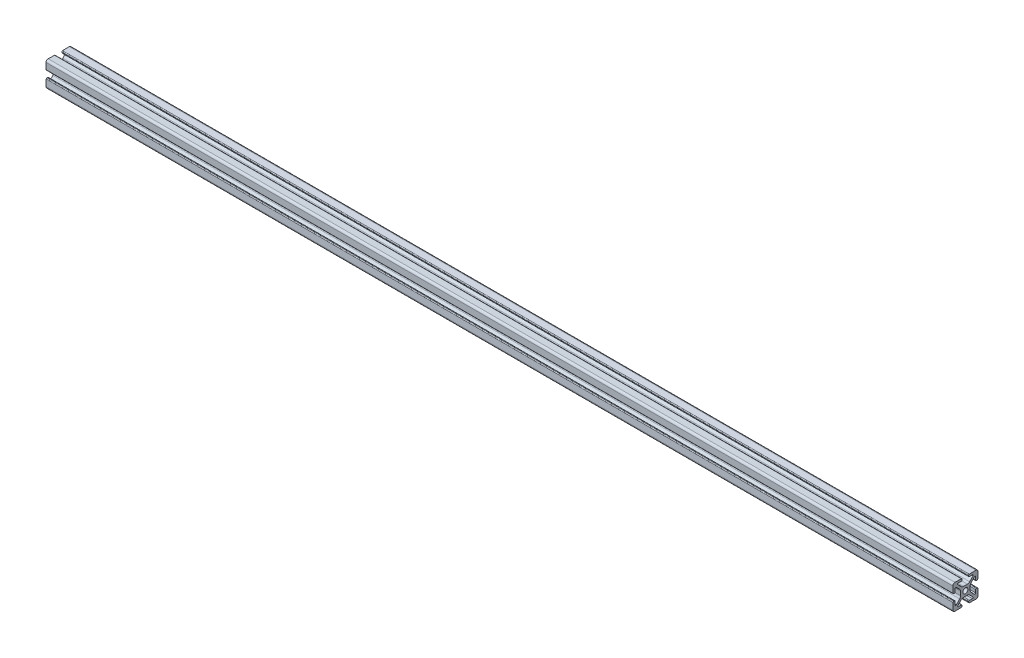
from build123d import *

# Parameters (mm, degrees)
BOSS_EXTRUDE1_DEPTH      = 457.2
BOSS_EXTRUDE1_DEPTH_BACK = 457.2


with BuildPart() as part:
    # Sketch3 → Boss-Extrude1 (new, two sides: drawn at the far end of the back side and taken through both)
    with BuildSketch(Plane(origin=(0, 0, 0), x_dir=(0, 0, -1), z_dir=(1, 0, 0)).offset(-BOSS_EXTRUDE1_DEPTH_BACK)):
        with BuildLine():
            Line((0, 4.826), (1.984228399, 4.826))
            ThreePointArc((1.984228399, 4.826), (3.199248297, 5.067682484), (4.229292429, 5.75593597))
            Line((4.229292429, 5.75593597), (7.586577723, 9.113221264))
            ThreePointArc((7.586577723, 9.113221264), (7.746562132, 9.955883421), (7.021168939, 10.413572441))
            Line((7.021168939, 10.413572441), (4.090593416, 10.311234489))
            ThreePointArc((4.090593416, 10.311234489), (3.534670322, 10.524633371), (3.302, 11.072770299))
            Line((3.302, 11.072770299), (3.302, 11.70815736))
            ThreePointArc((3.302, 11.70815736), (3.515863072, 12.237487038), (4.037406584, 12.46969317))
            Line((4.037406584, 12.46969317), (10.597084223, 12.698762161))
            ThreePointArc((10.597084223, 12.698762161), (12.104840979, 12.104840979), (12.698762161, 10.597084223))
            Line((12.698762161, 10.597084223), (12.46969317, 4.037406584))
            ThreePointArc((12.46969317, 4.037406584), (12.237487038, 3.515863072), (11.70815736, 3.302))
            Line((11.70815736, 3.302), (11.072770299, 3.302))
            ThreePointArc((11.072770299, 3.302), (10.524633371, 3.534670322), (10.311234489, 4.090593416))
            Line((10.311234489, 4.090593416), (10.413572441, 7.021168939))
            ThreePointArc((10.413572441, 7.021168939), (9.955883421, 7.746562132), (9.113221264, 7.586577723))
            Line((9.113221264, 7.586577723), (5.75593597, 4.229292429))
            ThreePointArc((5.75593597, 4.229292429), (5.067682484, 3.199248297), (4.826, 1.984228399))
            Line((4.826, 1.984228399), (4.826, 0))
            Line((4.826, 0), (2.54, 0))
            ThreePointArc((2.54, 0), (1.796051224, 1.796051224), (0, 2.54))
            Line((0, 2.54), (0, 4.826))
        make_face()
    extrude(amount=BOSS_EXTRUDE1_DEPTH + BOSS_EXTRUDE1_DEPTH_BACK)

    # Mirror1: part across plane


with BuildPart() as part_1:
    add(part.part)
    add(part.part.mirror(Plane.ZX))

    # Mirror2: part across plane


with BuildPart() as part_2:
    add(part_1.part)
    add(part_1.part.mirror(Plane.XY))


solid = part_2.part
